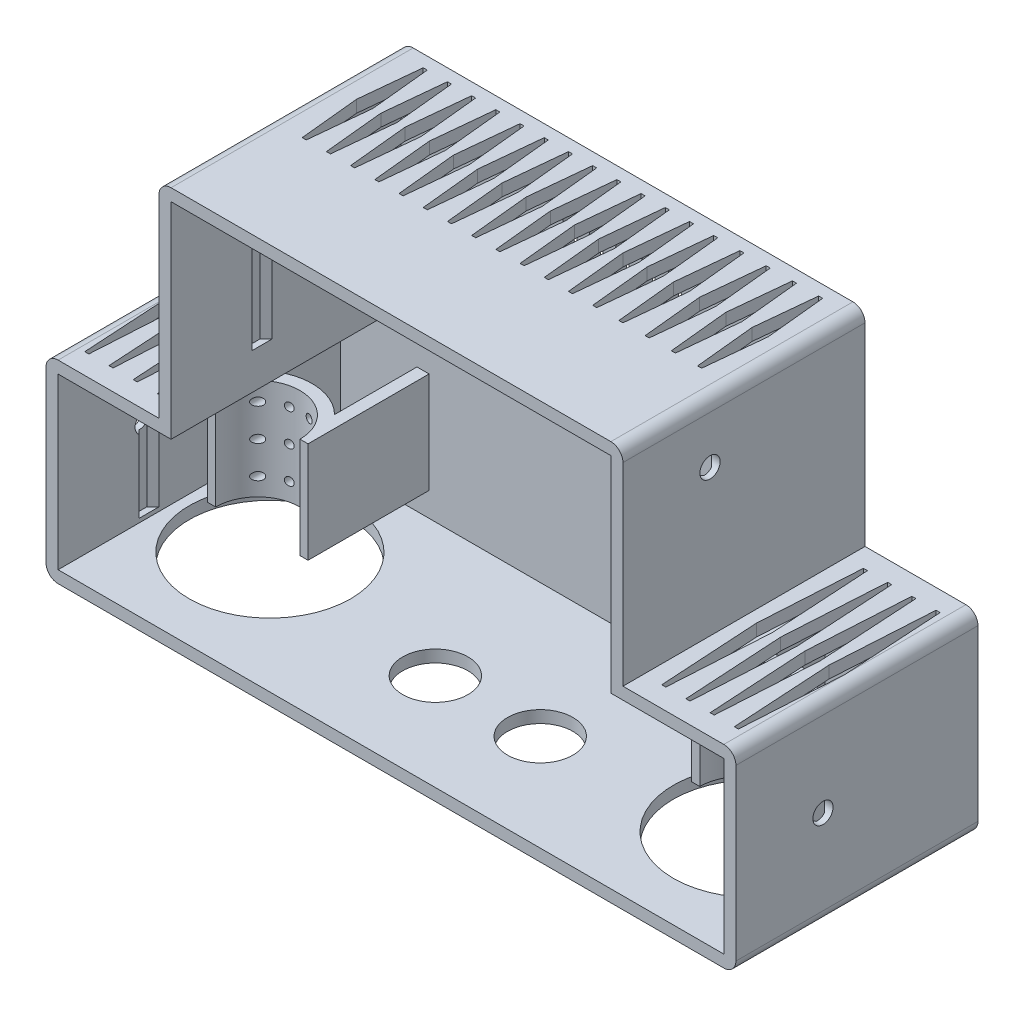
from build123d import *

# Parameters (mm, degrees)
SKETCH1_R               = 2.3
SKETCH1_R_2             = 1.8
SKETCH1_W               = 10
SKETCH1_H               = 10
SKETCH1_W_2             = 69.4
SKETCH1_H_2             = 22.3
SKETCH1_W_3             = 6.1
SKETCH1_H_3             = 13
BOSS_EXTRUDE1_DEPTH     = 3
BOSS_EXTRUDE2_DEPTH     = 57
FILLET1_R               = 3
CUT_EXTRUDE2_DEPTH      = 16
CUT_EXTRUDE2_DEPTH_BACK = 25
CUT_EXTRUDE3_START      = -35
CUT_EXTRUDE3_DEPTH      = 40
SKETCH6_R               = 8.1
SKETCH6_R_2             = 20
CUT_EXTRUDE4_DEPTH      = 3
CUT_EXTRUDE5_DEPTH      = 184.98369493
CUT_EXTRUDE5_DEPTH_BACK = 184.98369493
SKETCH7_R               = 2.5
CUT_EXTRUDE6_DEPTH      = 10
CUT_EXTRUDE7_DEPTH      = 10
BOSS_EXTRUDE3_START     = 2
BOSS_EXTRUDE3_DEPTH     = 25
SKETCH12_R              = 1
CUT_EXTRUDE8_DEPTH      = 20
CUT_EXTRUDE9_DEPTH      = 3


with BuildPart() as part:
    # Sketch1 → Boss-Extrude1 (new body)
    # profile 1 of 7: a face of its own
    with BuildSketch(Plane.XY):
        Polygon((0, -51), (28, -51), (28, -99), (0, -99), (-115, -99), (-143, -99), (-143, -51), (-115, -51), (-115, 0), (0, 0), align=None)
        with Locations((-19.5, -32.493549158)):
            Circle(SKETCH1_R, mode=Mode.SUBTRACT)
        with Locations((-57.5, -10.395373235)):
            Circle(SKETCH1_R_2, mode=Mode.SUBTRACT)
        with Locations((-17.5, -53.697377152)):
            Rectangle(SKETCH1_W, SKETCH1_H, mode=Mode.SUBTRACT)
        with Locations((-97.5, -53.697377152)):
            Rectangle(SKETCH1_W, SKETCH1_H, mode=Mode.SUBTRACT)
        with Locations((-44.022302804, -79.85)):
            Rectangle(SKETCH1_W_2, SKETCH1_H_2, mode=Mode.SUBTRACT)
        with Locations((-95.5, -32.493549158)):
            Rectangle(SKETCH1_W_3, SKETCH1_H_3, mode=Mode.SUBTRACT)
    # profile 2 of 7: a face of its own
    with BuildSketch(Plane.XY):
        with Locations((-95.5, -32.493549158)):
            Rectangle(SKETCH1_W_3, SKETCH1_H_3)
    # profile 3 of 7: a face of its own
    with BuildSketch(Plane.XY):
        with Locations((-97.5, -53.697377152)):
            Rectangle(SKETCH1_W, SKETCH1_H)
    # profile 4 of 7: a face of its own
    with BuildSketch(Plane.XY):
        with Locations((-44.022302804, -79.85)):
            Rectangle(SKETCH1_W_2, SKETCH1_H_2)
    # profile 5 of 7: a face of its own
    with BuildSketch(Plane.XY):
        with Locations((-17.5, -53.697377152)):
            Rectangle(SKETCH1_W, SKETCH1_H)
    # profile 6 of 7: a face of its own
    with BuildSketch(Plane.XY):
        with Locations((-19.5, -32.493549158)):
            Circle(SKETCH1_R)
    # profile 7 of 7: a face of its own
    with BuildSketch(Plane.XY):
        with Locations((-57.5, -10.395373235)):
            Circle(SKETCH1_R_2)
    extrude(amount=BOSS_EXTRUDE1_DEPTH)

    # Sketch3 → Boss-Extrude2 (add)
    with BuildSketch(Plane.XY.offset(3)):
        Polygon((28, -51), (0, -51), (0, 0), (-115, 0), (-115, -51), (-143, -51), (-143, -99), (28, -99), align=None)
        Polygon((25, -54), (-3, -54), (-3, -3), (-112, -3), (-112, -54), (-140, -54), (-140, -96), (25, -96), align=None, mode=Mode.SUBTRACT)
    extrude(amount=BOSS_EXTRUDE2_DEPTH)

    # Fillet1
    fillet1_edges = [part.edges().sort_by_distance(p)[0] for p in [
        (28, -51, 30),
        (28, -99, 30),
        (-143, -99, 30),
        (-143, -51, 30),
        (-115, 0, 30),
        (0, 0, 30),
    ]]
    fillet(fillet1_edges, radius=FILLET1_R)

    # Sketch4 → Cut-Extrude2 (cut, two sides: drawn at the far end of the back side and taken through both)
    with BuildSketch(Plane(origin=(0, -20, 0), x_dir=(1, 0, 0), z_dir=(0, 1, 0)).offset(-CUT_EXTRUDE2_DEPTH_BACK)):
        Polygon((-113.5, -36.5), (-112, -35), (-112, -40), (-113.5, -38.5), align=None)
        Polygon((-3, -35), (-3, -40), (-1.5, -38.5), (-1.5, -36.5), align=None)
    extrude(amount=CUT_EXTRUDE2_DEPTH + CUT_EXTRUDE2_DEPTH_BACK, mode=Mode.SUBTRACT)

    # Sketch5 → Cut-Extrude3 (cut)
    with BuildSketch(Plane(origin=(0, -20, 0), x_dir=(1, 0, 0), z_dir=(0, 1, 0)).offset(CUT_EXTRUDE3_START)):
        Polygon((25, -35), (25, -40), (26.5, -38.5), (26.5, -36.5), align=None)
        Polygon((-140, -40), (-141.5, -38.5), (-141.5, -36.5), (-140, -35), align=None)
    extrude(amount=-CUT_EXTRUDE3_DEPTH, mode=Mode.SUBTRACT)

    # Sketch6 → Cut-Extrude4 (cut)
    with BuildSketch(Plane.XZ.offset(99)):
        with Locations((-70.5, 36)):
            Circle(SKETCH6_R)
        with Locations((-117.5, 30)):
            Circle(SKETCH6_R_2)
        with Locations(Location((-44.5, 36, 0), (0, 0, 90))):
            Circle(SKETCH6_R)
        with Locations(Location((2.5, 30, 0), (0, 0, 90))):
            Circle(SKETCH6_R_2)
    extrude(amount=-CUT_EXTRUDE4_DEPTH, mode=Mode.SUBTRACT)

    # Sketch7 → Cut-Extrude5 (cut, two sides: drawn at the far end of the back side and taken through both)
    with BuildSketch(Plane.ZY.offset(115).offset(-CUT_EXTRUDE5_DEPTH_BACK)):
        with Locations(Location((38.421684909, -14.812413605, 0), (0, 0, 271.795143368))):
            Circle(SKETCH7_R)
        with Locations(Location((38.421684909, -75, 0), (0, 0, 270))):
            Circle(SKETCH7_R)
    extrude(amount=CUT_EXTRUDE5_DEPTH + CUT_EXTRUDE5_DEPTH_BACK, mode=Mode.SUBTRACT)

    # Sketch8 → Cut-Extrude6 (cut)
    with BuildSketch(Plane(origin=(0, 0, 0), x_dir=(1, 0, 0), z_dir=(0, 1, 0))):
        Polygon((-34.5, -3), (-33.5, -3), (-32, -18), (-33.5, -33), (-34.5, -33), (-36, -18), align=None)
        Polygon((-28, -3), (-27, -3), (-25.5, -18), (-27, -33), (-28, -33), (-29.5, -18), align=None)
        Polygon((-21.5, -3), (-20.5, -3), (-19, -18), (-20.5, -33), (-21.5, -33), (-23, -18), align=None)
        Polygon((-15, -3), (-14, -3), (-12.5, -18), (-14, -33), (-15, -33), (-16.5, -18), align=None)
        Polygon((-8.5, -3), (-7.5, -3), (-6, -18), (-7.5, -33), (-8.5, -33), (-10, -18), align=None)
        Polygon((-39.5, -3), (-38, -18), (-39.5, -33), (-40.5, -33), (-42, -18), (-40.5, -3), align=None)
        Polygon((-45.5, -3), (-44, -18), (-45.5, -33), (-46.5, -33), (-48, -18), (-46.5, -3), align=None)
        Polygon((-51.5, -3), (-50, -18), (-51.5, -33), (-52.5, -33), (-54, -18), (-52.5, -3), align=None)
        Polygon((-57.5, -3), (-56, -18), (-57.5, -33), (-58.5, -33), (-60, -18), (-58.5, -3), align=None)
        Polygon((-63.5, -3), (-62, -18), (-63.5, -33), (-64.5, -33), (-66, -18), (-64.5, -3), align=None)
        Polygon((-69.5, -3), (-68, -18), (-69.5, -33), (-70.5, -33), (-72, -18), (-70.5, -3), align=None)
        Polygon((-75.5, -3), (-74, -18), (-75.5, -33), (-76.5, -33), (-78, -18), (-76.5, -3), align=None)
        Polygon((-81.5, -3), (-80, -18), (-81.5, -33), (-82.5, -33), (-84, -18), (-82.5, -3), align=None)
        Polygon((-87.5, -3), (-86, -18), (-87.5, -33), (-88.5, -33), (-90, -18), (-88.5, -3), align=None)
        Polygon((-96, -18), (-94.5, -3), (-93.5, -3), (-92, -18), (-93.5, -33), (-94.5, -33), align=None)
        Polygon((-102, -18), (-100.5, -3), (-99.5, -3), (-98, -18), (-99.5, -33), (-100.5, -33), align=None)
        Polygon((-108, -18), (-106.5, -3), (-105.5, -3), (-104, -18), (-105.5, -33), (-106.5, -33), align=None)
    extrude(amount=-CUT_EXTRUDE6_DEPTH, mode=Mode.SUBTRACT)

    # Sketch10 → Cut-Extrude7 (cut)
    with BuildSketch(Plane(origin=(0, 0, 0), x_dir=(-1, 0, 0), z_dir=(0, 0, -1))):
        Polygon((43.770674826, -4.319215941), (44.770674826, -4.319215941), (46.270674826, -19.319215941), (44.770674826, -34.319215941), (43.770674826, -34.319215941), (42.270674826, -19.319215941), align=None)
        Polygon((51.270674826, -4.319215941), (52.770674826, -19.319215941), (51.270674826, -34.319215941), (50.270674826, -34.319215941), (48.770674826, -19.319215941), (50.270674826, -4.319215941), align=None)
        Polygon((57.770674826, -4.319215941), (59.270674826, -19.319215941), (57.770674826, -34.319215941), (56.770674826, -34.319215941), (55.270674826, -19.319215941), (56.770674826, -4.319215941), align=None)
        Polygon((64.270674826, -4.319215941), (65.770674826, -19.319215941), (64.270674826, -34.319215941), (63.270674826, -34.319215941), (61.770674826, -19.319215941), (63.270674826, -4.319215941), align=None)
        Polygon((70.770674826, -4.319215941), (72.270674826, -19.319215941), (70.770674826, -34.319215941), (69.770674826, -34.319215941), (68.270674826, -19.319215941), (69.770674826, -4.319215941), align=None)
    extrude(amount=-CUT_EXTRUDE7_DEPTH, mode=Mode.SUBTRACT)

    # Sketch11 → Boss-Extrude3 (add)
    with BuildSketch(Plane(origin=(0, -92, 0), x_dir=(1, 0, 0), z_dir=(0, 1, 0)).offset(BOSS_EXTRUDE3_START)):
        with BuildLine():
            Line((14.95, -3), (14.95, -33))
            Line((14.95, -33), (12.95, -33))
            ThreePointArc((12.95, -33), (2.5, -22.55), (-7.95, -33))
            Line((-7.95, -33), (-9.95, -33))
            Line((-9.95, -33), (-9.95, -3))
            Line((-9.95, -3), (-6.95, -3))
            Line((-6.95, -3), (-6.95, -6))
            Line((-6.95, -6), (-6.95, -23.429211109))
            ThreePointArc((-6.95, -23.429211109), (2.5, -19.55), (11.95, -23.429211109))
            Line((11.95, -23.429211109), (11.95, -6))
            Line((11.95, -6), (11.95, -3))
            Line((11.95, -3), (14.95, -3))
        make_face()
        with BuildLine():
            Line((-108.05, -3), (-105.05, -3))
            Line((-105.05, -3), (-105.05, -33))
            Line((-105.05, -33), (-107.05, -33))
            ThreePointArc((-107.05, -33), (-117.5, -22.55), (-127.95, -33))
            Line((-127.95, -33), (-129.95, -33))
            Line((-129.95, -33), (-129.95, -3))
            Line((-129.95, -3), (-126.95, -3))
            Line((-126.95, -3), (-126.95, -6))
            Line((-126.95, -6), (-126.95, -23.429211109))
            ThreePointArc((-126.95, -23.429211109), (-117.5, -19.55), (-108.05, -23.429211109))
            Line((-108.05, -23.429211109), (-108.05, -6))
            Line((-108.05, -6), (-108.05, -3))
        make_face()
    extrude(amount=BOSS_EXTRUDE3_DEPTH)

    # Sketch12 → Cut-Extrude8 (cut)
    with BuildSketch(Plane.XY.offset(33)):
        with Locations((-124.841334281, -69.555324023)):
            Circle(SKETCH12_R)
        with Locations((-119.841334281, -69.555324023)):
            Circle(SKETCH12_R)
        with Locations((-114.841334281, -69.555324023)):
            Circle(SKETCH12_R)
        with Locations((-109.841334281, -69.555324023)):
            Circle(SKETCH12_R)
        with Locations((-119.841334281, -77.555324023)):
            Circle(SKETCH12_R)
        with Locations((-114.841334281, -77.555324023)):
            Circle(SKETCH12_R)
        with Locations((-109.841334281, -77.555324023)):
            Circle(SKETCH12_R)
        with Locations((-119.841334281, -85.555324023)):
            Circle(SKETCH12_R)
        with Locations((-114.841334281, -85.555324023)):
            Circle(SKETCH12_R)
        with Locations((-109.841334281, -85.555324023)):
            Circle(SKETCH12_R)
        with Locations((-124.841334281, -77.555324023)):
            Circle(SKETCH12_R)
        with Locations((-124.841334281, -85.555324023)):
            Circle(SKETCH12_R)
        with Locations((-5.158665719, -85.555324023)):
            Circle(SKETCH12_R)
        with Locations((-0.158665719, -85.555324023)):
            Circle(SKETCH12_R)
        with Locations((4.841334281, -85.555324023)):
            Circle(SKETCH12_R)
        with Locations((9.841334281, -85.555324023)):
            Circle(SKETCH12_R)
        with Locations((4.841334281, -77.555324023)):
            Circle(SKETCH12_R)
        with Locations((9.841334281, -77.555324023)):
            Circle(SKETCH12_R)
        with Locations((-0.158665719, -77.555324023)):
            Circle(SKETCH12_R)
        with Locations((-5.158665719, -77.555324023)):
            Circle(SKETCH12_R)
        with Locations((-5.158665719, -69.555324023)):
            Circle(SKETCH12_R)
        with Locations((-0.158665719, -69.555324023)):
            Circle(SKETCH12_R)
        with Locations((4.841334281, -69.555324023)):
            Circle(SKETCH12_R)
        with Locations((9.841334281, -69.555324023)):
            Circle(SKETCH12_R)
    extrude(amount=-CUT_EXTRUDE8_DEPTH, mode=Mode.SUBTRACT)

    # Sketch14 → Cut-Extrude9 (cut)
    with BuildSketch(Plane(origin=(0, -51, 0), x_dir=(1, 0, 0), z_dir=(0, 1, 0))):
        Polygon((5.5, -4.890021014), (4.5, -4.890021014), (3, -29.890021014), (4.5, -54.890021014), (5.5, -54.890021014), (7, -29.890021014), align=None)
        Polygon((11.5, -4.890021014), (10.5, -4.890021014), (9, -29.890021014), (10.5, -54.890021014), (11.5, -54.890021014), (13, -29.890021014), align=None)
        Polygon((25, -29.890021014), (23.5, -4.890021014), (22.5, -4.890021014), (21, -29.890021014), (22.5, -54.890021014), (23.5, -54.890021014), align=None)
        Polygon((-125.5, -54.890021014), (-126.5, -54.890021014), (-128, -29.890021014), (-126.5, -4.890021014), (-125.5, -4.890021014), (-124, -29.890021014), align=None)
        Polygon((-131.5, -54.890021014), (-132.5, -54.890021014), (-134, -29.890021014), (-132.5, -4.890021014), (-131.5, -4.890021014), (-130, -29.890021014), align=None)
        Polygon((-140, -29.890021014), (-138.5, -4.890021014), (-137.5, -4.890021014), (-136, -29.890021014), (-137.5, -54.890021014), (-138.5, -54.890021014), align=None)
        Polygon((19, -29.890021014), (17.5, -4.890021014), (16.5, -4.890021014), (15, -29.890021014), (16.5, -54.890021014), (17.5, -54.890021014), align=None)
        Polygon((-118, -29.890021014), (-119.5, -54.890021014), (-120.5, -54.890021014), (-122, -29.890021014), (-120.5, -4.890021014), (-119.5, -4.890021014), align=None)
    extrude(amount=-CUT_EXTRUDE9_DEPTH, mode=Mode.SUBTRACT)


solid = part.part
